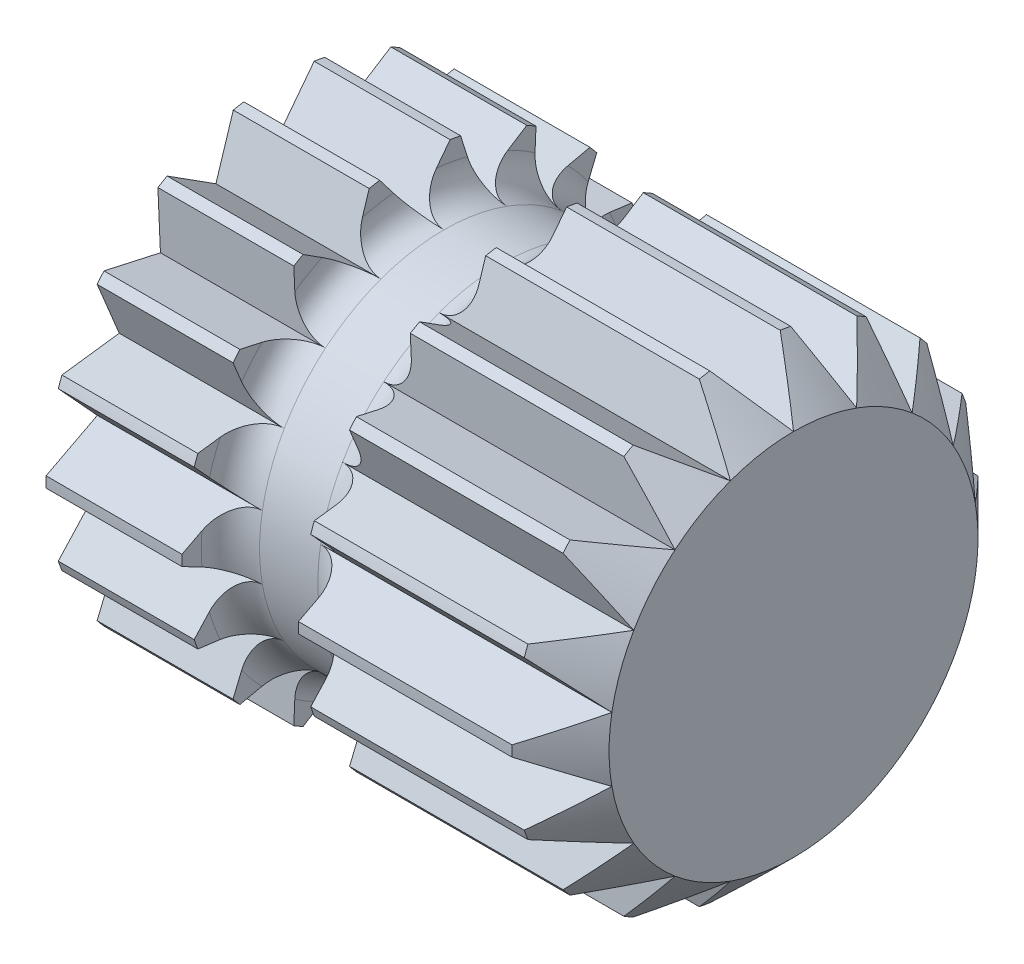
from build123d import *

# Parameters (mm, degrees)
HOLE_WIZARD_M31_D        = 2.5
HOLE_WIZARD_M31_DEPTH    = 4.5
HOLE_WIZARD_M31_TIP      = 0.751075774
CHAMFER_1_SIZE           = 0.5
CUT_EXTRUDE_1_DEPTH      = 7.293647591
PATTERN_CIRCULAR_1_COUNT = 18


with BuildPart() as part:
    # Эскиз1 → Повернуть1 (revolve)
    with BuildSketch(Plane.XY, mode=Mode.PRIVATE) as revolve_1_sk:
        with BuildLine():
            Line((0, 2.4), (1.4, 2.4))
            Line((1.4, 2.4), (1.4, 2.2))
            ThreePointArc((1.4, 2.2), (1.487867966, 1.987867966), (1.7, 1.9))
            Line((1.7, 1.9), (2.3, 1.9))
            ThreePointArc((2.3, 1.9), (2.512132034, 1.987867966), (2.6, 2.2))
            Line((2.6, 2.2), (2.6, 2.4))
            Line((2.6, 2.4), (4.8, 2.4))
            Line((4.8, 2.4), (5.3, 1.9))
            Line((5.3, 1.9), (5.3, 0))
            Line((5.3, 0), (3, 0))
            Line((3, 0), (3, 1))
            Line((3, 1), (0, 1))
            Line((0, 1), (0, 2.4))
        make_face()
    revolve(revolve_1_sk.sketch.rotate(Axis((0, 0, 0), (1, 0, 0)), 90), axis=Axis((0, 0, 0), (1, 0, 0)))

    # Отверстие обработанное метчиком M31
    with Locations(Plane.ZY):
        with Locations((0, 0)):
            Hole(HOLE_WIZARD_M31_D / 2, depth=HOLE_WIZARD_M31_DEPTH)
            with Locations((0, 0, -(HOLE_WIZARD_M31_DEPTH + HOLE_WIZARD_M31_TIP / 2))):  # 118° drill point
                Cone(0, HOLE_WIZARD_M31_D / 2, HOLE_WIZARD_M31_TIP, mode=Mode.SUBTRACT)

    # Фаска1
    chamfer_1_edges = [part.edges().sort_by_distance(p)[0] for p in [
        (0, 0, 1.25),
    ]]
    chamfer(chamfer_1_edges, length=CHAMFER_1_SIZE)

    # Эскиз4 → Вырез-Вытянуть1 (cut, through all)
    with BuildSketch(Plane.ZY):
        Polygon((-0.383663494, 2.4), (0, 1.9), (0.383663494, 2.4), align=None)
    cut_extrude_1 = extrude(amount=-CUT_EXTRUDE_1_DEPTH, mode=Mode.SUBTRACT)

    # Круговой массив1: Вырез-Вытянуть1 ×18 about axis
    pattern_circular_1_axis = Axis((0, 0, 0), (1, 0, 0))
    for i in range(1, PATTERN_CIRCULAR_1_COUNT):
        add(cut_extrude_1.rotate(pattern_circular_1_axis, i * 360 / PATTERN_CIRCULAR_1_COUNT), mode=Mode.SUBTRACT)


solid = part.part
